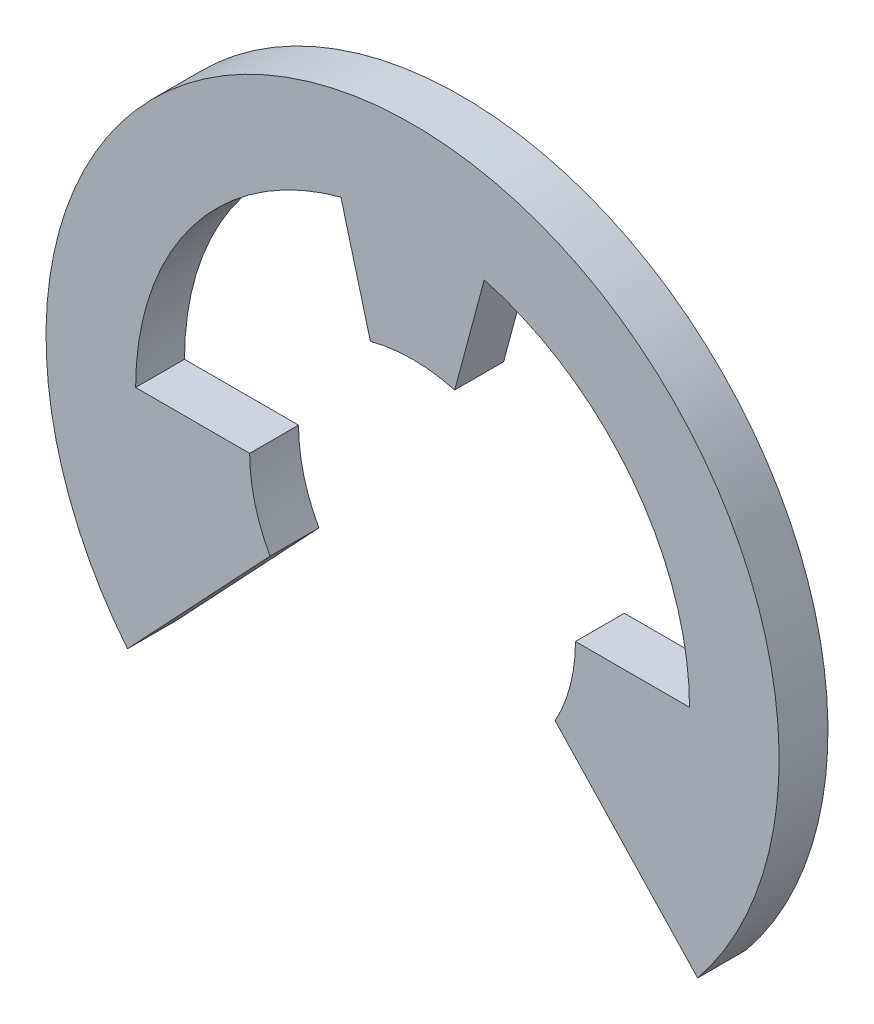
from build123d import *

# Parameters (mm, degrees)
EXTRUDE_1_DEPTH      = 0.3
EXTRUDE_1_DEPTH_BACK = 0.3


with BuildPart() as part:
    # 草圖1 → 填料-伸長1 (new, two sides: drawn at the far end of the back side and taken through both)
    with BuildSketch(Plane.XY.offset(-EXTRUDE_1_DEPTH_BACK)):
        with BuildLine():
            Line((-3.5, -2.828427125), (-1.75, -0.968245837))
            ThreePointArc((-1.75, -0.968245837), (-1.936491673, -0.5), (-2, 0))
            Line((-2, 0), (-3.4, 0))
            ThreePointArc((-3.4, 0), (-2.697401357, 2.069788859), (-0.879984753, 3.284147809))
            Line((-0.879984753, 3.284147809), (-0.51763809, 1.931851653))
            ThreePointArc((-0.51763809, 1.931851653), (0, 2), (0.51763809, 1.931851653))
            Line((0.51763809, 1.931851653), (0.879984753, 3.284147809))
            ThreePointArc((0.879984753, 3.284147809), (2.697401357, 2.069788859), (3.4, 0))
            Line((3.4, 0), (2, 0))
            ThreePointArc((2, 0), (1.936491673, -0.5), (1.75, -0.968245837))
            Line((1.75, -0.968245837), (3.5, -2.828427125))
            ThreePointArc((3.5, -2.828427125), (0, 4.5), (-3.5, -2.828427125))
        make_face()
    extrude(amount=EXTRUDE_1_DEPTH + EXTRUDE_1_DEPTH_BACK)


solid = part.part
